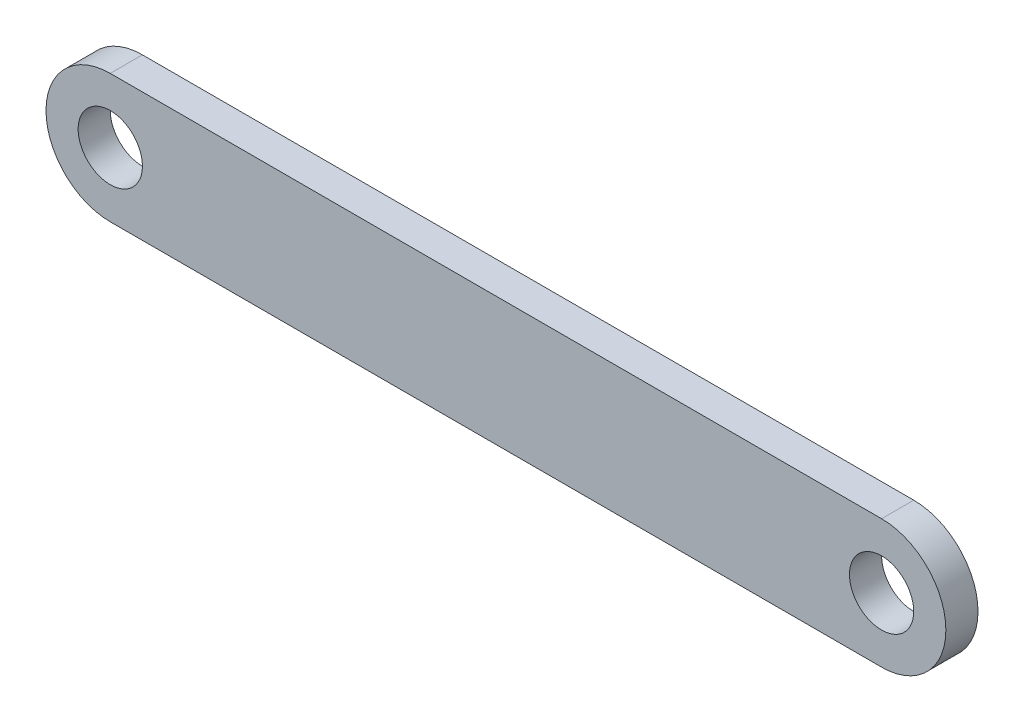
from build123d import *

# Parameters (mm, degrees)
SKETCH1_R           = 5
BOSS_EXTRUDE2_DEPTH = 5


with BuildPart() as part:
    # Sketch1 → Boss-Extrude2 (new body)
    with BuildSketch(Plane.XY):
        with BuildLine():
            Line((60, -10), (-60, -10))
            ThreePointArc((-60, -10), (-70, 0), (-60, 10))
            Line((-60, 10), (60, 10))
            ThreePointArc((60, 10), (70, 0), (60, -10))
        make_face()
        with Locations((-60, 0)):
            Circle(SKETCH1_R, mode=Mode.SUBTRACT)
        with Locations((60, 0)):
            Circle(SKETCH1_R, mode=Mode.SUBTRACT)
    extrude(amount=BOSS_EXTRUDE2_DEPTH)


solid = part.part
